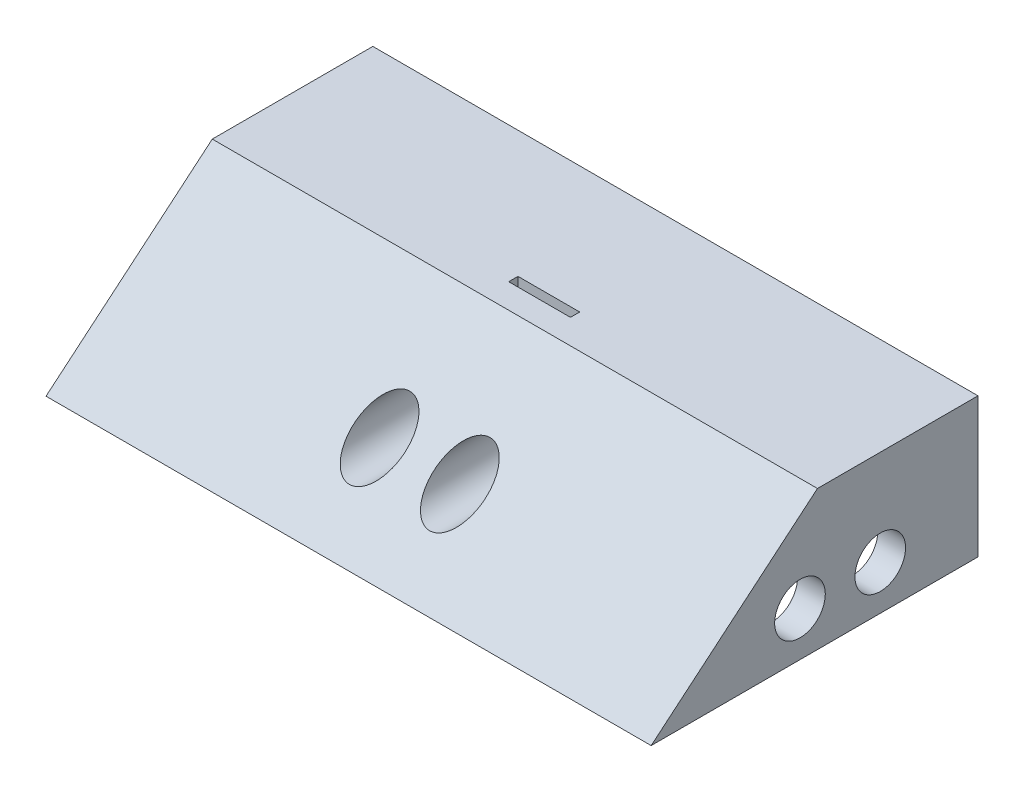
from build123d import *

# Parameters (mm, degrees)
SALIENTE_EXTRUIR1_DEPTH = 196
VACIADO1_T              = -4
CROQUIS2_R              = 8.2
CORTAR_EXTRUIR1_DEPTH   = 4
CROQUIS3_R              = 9.2
CROQUIS3_R_2            = 8.2
SALIENTE_EXTRUIR2_DEPTH = 9
REDONDEO3_R             = 3
REDONDEO4_R             = 3
CORTAR_EXTRUIR2_REACH   = 229.294
CROQUIS4_R              = 8.2
CROQUIS5_R              = 9.2
CROQUIS5_R_2            = 8.2
SALIENTE_EXTRUIR3_DEPTH = 43
CROQUIS6_W              = 82.873764354
CROQUIS6_H              = 43.688886644
CORTAR_EXTRUIR3_DEPTH   = 21.855248
CORTAR_EXTRUIR4_REACH   = 229.294
CROQUIS9_W              = 20
CROQUIS9_H              = 3


with BuildPart() as part:
    # Croquis1 → Saliente-Extruir1 (new body)
    with BuildSketch(Plane(origin=(0, 0, 0), x_dir=(0, 0, -1), z_dir=(1, 0, 0))):
        Polygon((0, 0), (105.85, 0), (105.85, 45.19), (53.855344849, 45.19), align=None)
    extrude(amount=SALIENTE_EXTRUIR1_DEPTH)

    # Vaciado1
    vaciado1_openings = [part.faces().sort_by_distance(p)[0] for p in [
        (98, 0, -52.925),
    ]]
    offset(amount=VACIADO1_T, openings=vaciado1_openings, kind=Kind.INTERSECTION)

    # Croquis2 → Cortar-Extruir1 (cut)
    with BuildSketch(Plane(origin=(196, 0, 0), x_dir=(0, 0, -1), z_dir=(1, 0, 0))):
        with Locations((48.192305519, 14.33)):
            Circle(CROQUIS2_R)
        with Locations((74.192305519, 14.33)):
            Circle(CROQUIS2_R)
    cortar_extruir1 = extrude(amount=-CORTAR_EXTRUIR1_DEPTH, mode=Mode.SUBTRACT)

    # Croquis3 → Saliente-Extruir2 (add)
    # profile 1 of 2: a face of its own
    with BuildSketch(Plane(origin=(196, 0, 0), x_dir=(0, 0, -1), z_dir=(1, 0, 0))):
        with Locations((48.192305519, 14.33)):
            Circle(CROQUIS3_R)
        with Locations((48.192305519, 14.33)):
            Circle(CROQUIS3_R_2, mode=Mode.SUBTRACT)
    # profile 2 of 2: a face of its own
    with BuildSketch(Plane(origin=(196, 0, 0), x_dir=(0, 0, -1), z_dir=(1, 0, 0))):
        with Locations((74.192305519, 14.33)):
            Circle(CROQUIS3_R)
        with Locations((74.192305519, 14.33)):
            Circle(CROQUIS3_R_2, mode=Mode.SUBTRACT)
    saliente_extruir2 = extrude(amount=-SALIENTE_EXTRUIR2_DEPTH)

    # Redondeo3
    redondeo3_edges = [part.edges().sort_by_distance(p)[0] for p in [
        (192, 14.33, -38.992305519),
        (192, 14.33, -64.992305519),
    ]]
    fillet(redondeo3_edges, radius=REDONDEO3_R)

    # Simetría1: Cortar-Extruir1, Saliente-Extruir2 across plane
    add(cortar_extruir1.mirror(Plane(origin=(98, 0, 0), x_dir=(0, 0, 1), z_dir=(1, 0, 0))), mode=Mode.SUBTRACT)
    add(saliente_extruir2.mirror(Plane(origin=(98, 0, 0), x_dir=(0, 0, 1), z_dir=(1, 0, 0))))

    # Redondeo4
    redondeo4_edges = [part.edges().sort_by_distance(p)[0] for p in [
        (4, 14.33, -38.992305519),
        (4, 14.33, -64.992305519),
    ]]
    fillet(redondeo4_edges, radius=REDONDEO4_R)

    # Cortar-Extruir2: up to this plane
    cortar_extruir2_end = Plane(origin=(196, -3.064177772, -2.571150439), z_dir=(0, -0.7660444431189772, -0.6427876096865404))
    # Croquis4 → Cortar-Extruir2 (cut, up to the surface)
    with BuildSketch(Plane.XY, mode=Mode.PRIVATE) as cortar_extruir2_sk1:
        with Locations(Location((85, 19.33, 0), (0, 0, 270))):
            Circle(CROQUIS4_R)
    cortar_extruir2_tool1 = split(extrude(cortar_extruir2_sk1.sketch, amount=-CORTAR_EXTRUIR2_REACH, mode=Mode.PRIVATE), bisect_by=cortar_extruir2_end, keep=Keep.BOTH, mode=Mode.PRIVATE)
    add(cortar_extruir2_tool1.solids().sort_by_distance((85, 19.33, 0))[0], mode=Mode.SUBTRACT)
    # Croquis4 → Cortar-Extruir2 (cut, up to the surface)
    with BuildSketch(Plane.XY, mode=Mode.PRIVATE) as cortar_extruir2_sk2:
        with Locations(Location((111, 19.33, 0), (0, 0, 270))):
            Circle(CROQUIS4_R)
    cortar_extruir2_tool2 = split(extrude(cortar_extruir2_sk2.sketch, amount=-CORTAR_EXTRUIR2_REACH, mode=Mode.PRIVATE), bisect_by=cortar_extruir2_end, keep=Keep.BOTH, mode=Mode.PRIVATE)
    add(cortar_extruir2_tool2.solids().sort_by_distance((111, 19.33, 0))[0], mode=Mode.SUBTRACT)

    # Croquis5 → Saliente-Extruir3 (add)
    # profile 1 of 2: a face of its own
    with BuildSketch(Plane.XY):
        with Locations((111, 19.33)):
            Circle(CROQUIS5_R)
        with Locations((111, 19.33)):
            Circle(CROQUIS5_R_2, mode=Mode.SUBTRACT)
    # profile 2 of 2: a face of its own
    with BuildSketch(Plane.XY):
        with Locations((85, 19.33)):
            Circle(CROQUIS5_R)
        with Locations((85, 19.33)):
            Circle(CROQUIS5_R_2, mode=Mode.SUBTRACT)
    extrude(amount=-SALIENTE_EXTRUIR3_DEPTH)

    # Croquis6 → Cortar-Extruir3 (cut)
    with BuildSketch(Plane(origin=(0, 0, 0), x_dir=(1, 0, 0), z_dir=(0, 0.7660444431189771, 0.6427876096865404))):
        with Locations((99.35120268, 26.550188106)):
            Rectangle(CROQUIS6_W, CROQUIS6_H)
    extrude(amount=CORTAR_EXTRUIR3_DEPTH, mode=Mode.SUBTRACT)

    # Croquis9 → Cortar-Extruir4 (cut, up to next)
    with BuildSketch(Plane(origin=(0, 45.19, 0), x_dir=(1, 0, 0), z_dir=(0, 1, 0)), mode=Mode.PRIVATE) as cortar_extruir4_sk1:
        with Locations((98, 63.355344849)):
            Rectangle(CROQUIS9_W, CROQUIS9_H)
    cortar_extruir4_tool1 = extrude(cortar_extruir4_sk1.sketch, amount=-CORTAR_EXTRUIR4_REACH, mode=Mode.PRIVATE) & part.part
    add(cortar_extruir4_tool1.solids().sort_by_distance((98, 45.19, -63.355345))[0], mode=Mode.SUBTRACT)


solid = part.part
